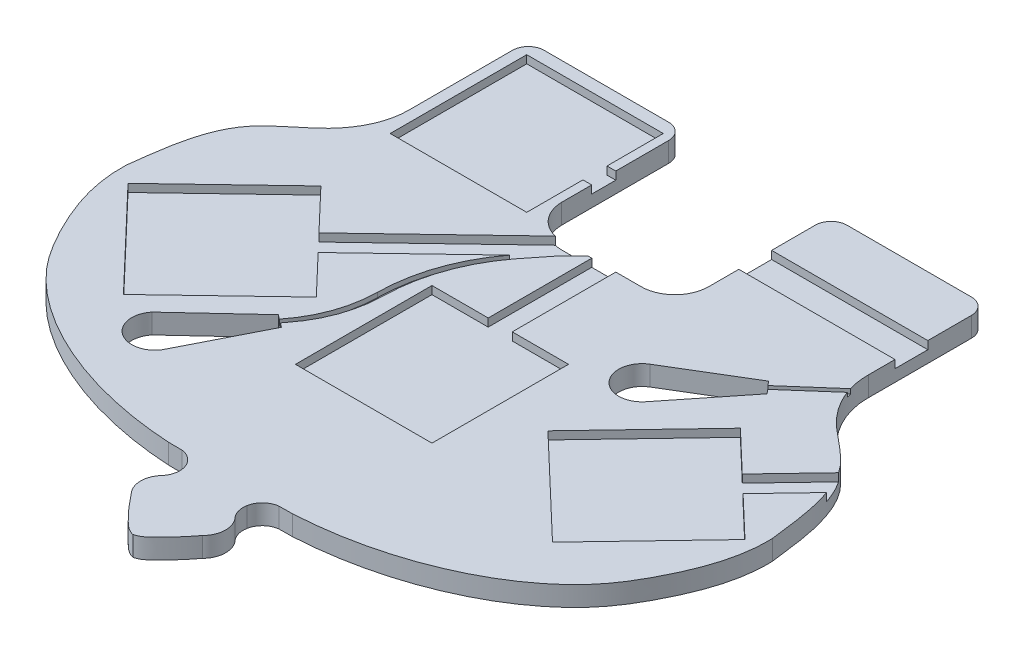
from build123d import *

# Parameters (mm, degrees)
BOSS_EXTRUDE1_DEPTH = 6.35
SKETCH2_W           = 43.7
SKETCH2_H           = 43.7
CUT_EXTRUDE1_DEPTH  = 2.54
CUT_EXTRUDE3_DEPTH  = 2.54
SKETCH4_W           = 2.8
SKETCH4_H           = 7.7
SKETCH4_W_2         = 7.7
SKETCH4_H_2         = 33.528
CUT_EXTRUDE4_DEPTH  = 2.54
CUT_EXTRUDE6_DEPTH  = 165.648464375
CUT_EXTRUDE7_DEPTH  = 1.5
SKETCH9_W           = 50
SKETCH9_H           = 10.5
CUT_EXTRUDE8_DEPTH  = 2.54


with BuildPart() as part:
    # Sketch1 → Boss-Extrude1 (new body)
    with BuildSketch(Plane(origin=(0, 0, 0), x_dir=(1, 0, 0), z_dir=(0, 1, 0))):
        with BuildLine():
            Line((52.544610399, 96), (92.384610399, 96))
            ThreePointArc((92.384610399, 96), (95.976712847, 94.512102448), (97.464610399, 90.92))
            Line((97.464610399, 90.92), (97.464610399, 57.942930422))
            add(Edge.make_bspline(
                [(127.445958891, -2.757399797), (126.217398064, 6.772879157), (124.527871566, 26.937506289), (103.198818931, 39.120916323), (97.37297865, 51.416446236), (97.464610399, 57.942930422)],
                knots=[0, 0, 0, 0, 0.4542014, 0.725733713, 1, 1, 1, 1], degree=3))
            add(Edge.make_bspline(
                [(127.445958891, -2.757399797), (127.822967418, -13.097877655), (122.880457127, -26.665652965), (112.775276891, -43.705151038), (101.21628269, -54.346897272), (78.643551493, -67.273421727), (58.317264726, -71.917502632), (43.855300998, -72.741727337)],
                knots=[0, 0, 0, 0, 0.251847695, 0.354064973, 0.49200618, 0.63769577, 1, 1, 1, 1], degree=3))
            Line((43.855300998, -72.741727337), (39.503738361, -72.784901588))
            ThreePointArc((39.503738361, -72.784901588), (36.074693376, -74.391591034), (34.256026209, -77.71307417))
            ThreePointArc((34.256026209, -77.71307417), (34.316151416, -80.336736497), (35.431566201, -82.712250947))
            ThreePointArc((35.431566201, -82.712250947), (37.591781392, -87.927471757), (35.431566201, -93.142692568))
            add(Edge.make_bspline(
                [(35.431566201, -93.142692568), (33.316240589, -95.95188132), (29.837032497, -99.83422186), (25.835087368, -103.598548459), (24, -104.01567246)],
                knots=[0, 0, 0, 0, 0.654699401, 1, 1, 1, 1], degree=3))
            add(Edge.make_bspline(
                [(12.568433799, -93.142692568), (14.683759411, -95.95188132), (18.162967503, -99.83422186), (22.164912632, -103.598548459), (24, -104.01567246)],
                knots=[0, 0, 0, 0, 0.654699401, 1, 1, 1, 1], degree=3))
            ThreePointArc((12.568433799, -93.142692568), (10.408218608, -87.927471757), (12.568433799, -82.712250947))
            ThreePointArc((12.568433799, -82.712250947), (13.683848584, -80.336736497), (13.743973791, -77.71307417))
            ThreePointArc((13.743973791, -77.71307417), (11.925306624, -74.391591034), (8.496261639, -72.784901588))
            Line((8.496261639, -72.784901588), (4.144699002, -72.741727337))
            add(Edge.make_bspline(
                [(-79.445958891, -2.757399797), (-79.822967418, -13.097877655), (-74.880457127, -26.665652965), (-64.775276891, -43.705151038), (-53.21628269, -54.346897272), (-30.643551493, -67.273421727), (-10.317264726, -71.917502632), (4.144699002, -72.741727337)],
                knots=[0, 0, 0, 0, 0.251847695, 0.354064973, 0.49200618, 0.63769577, 1, 1, 1, 1], degree=3))
            add(Edge.make_bspline(
                [(-79.445958891, -2.757399797), (-78.217398064, 6.772879157), (-76.527871566, 26.937506289), (-55.198818931, 39.120916323), (-49.37297865, 51.416446236), (-49.464610399, 57.942930422)],
                knots=[0, 0, 0, 0, 0.4542014, 0.725733713, 1, 1, 1, 1], degree=3))
            Line((-49.464610399, 57.942930422), (-49.464610399, 90.92))
            ThreePointArc((-49.464610399, 90.92), (-47.976712847, 94.512102448), (-44.384610399, 96))
            Line((-44.384610399, 96), (-4.544610399, 96))
            ThreePointArc((-4.544610399, 96), (-0.95250795, 94.512102448), (0.535389601, 90.92))
            Line((0.535389601, 90.92), (0.535389601, 56.693089242))
            ThreePointArc((0.535389601, 56.693089242), (3.823086605, 49.0674139), (11.540006197, 46))
            Line((11.540006197, 46), (36.459993803, 46))
            ThreePointArc((36.459993803, 46), (44.176913395, 49.0674139), (47.464610399, 56.693089242))
            Line((47.464610399, 56.693089242), (47.464610399, 90.92))
            ThreePointArc((47.464610399, 90.92), (48.95250795, 94.512102448), (52.544610399, 96))
        make_face()
    extrude(amount=BOSS_EXTRUDE1_DEPTH)

    # Sketch2 → Cut-Extrude1 (cut)
    with BuildSketch(Plane(origin=(0, 6.35, 0), x_dir=(1, 0, 0), z_dir=(0, 1, 0))):
        with Locations((-24.114610399, 70.15)):
            Rectangle(SKETCH2_W, SKETCH2_H)
        with Locations((24.69959658, -8.994026969)):
            Rectangle(SKETCH2_W, SKETCH2_H)
        Polygon((91.756041109, 22.663971871), (61.687394919, -8.87), (93.287751095, -39.001945738), (123.356397284, -7.467973867), align=None)
        Polygon((-44.043312702, -39.001945738), (-74.111958891, -7.467973867), (-42.511602716, 22.663971871), (-12.442956526, -8.87), align=None)
    extrude(amount=-CUT_EXTRUDE1_DEPTH, mode=Mode.SUBTRACT)

    # Sketch5 → Cut-Extrude3 (cut)
    with BuildSketch(Plane(origin=(0, 6.35, 0), x_dir=(1, 0, 0), z_dir=(0, 1, 0))):
        Polygon((104.769890137, 10.254852474), (122.226588264, 28.562262267), (128.147086585, 23.613346709), (110.342548256, 4.94114553), align=None)
        Polygon((11.522520215, 48.786329059), (-29.825516941, 9.359659151), (-24.511809997, 3.787001032), (16.836227159, 43.213670941), (19.758341498, 46), align=None)
    extrude(amount=-CUT_EXTRUDE3_DEPTH, mode=Mode.SUBTRACT)

    # Sketch4 → Cut-Extrude4 (cut)
    with BuildSketch(Plane(origin=(0, 6.35, 0), x_dir=(1, 0, 0), z_dir=(0, 1, 0))):
        with Locations((-0.864610399, 70.15)):
            Rectangle(SKETCH4_W, SKETCH4_H)
        with Locations((24.700041109, 29.236)):
            Rectangle(SKETCH4_W_2, SKETCH4_H_2)
    extrude(amount=-CUT_EXTRUDE4_DEPTH, mode=Mode.SUBTRACT)

    # Sketch6 → Cut-Extrude6 (cut, through all)
    with BuildSketch(Plane(origin=(0, 6.35, 0), x_dir=(1, 0, 0), z_dir=(0, 1, 0))):
        with BuildLine():
            Line((86.506282583, 36.458848797), (69.305686566, 14.862795995))
            ThreePointArc((69.305686566, 14.862795995), (57.802795593, 14.587410011), (59.565699046, 25.95774464))
            Line((59.565699046, 25.95774464), (83.207643636, 40.216372063))
            Line((83.207643636, 40.216372063), (86.506282583, 36.458848797))
        make_face()
        with BuildLine():
            Line((-10.890245417, -21.894543883), (-9.654995767, -22.825371259))
            Line((-9.654995767, -22.825371259), (-22.640520119, -48.35628634))
            ThreePointArc((-22.640520119, -48.35628634), (-33.316925376, -50.071712063), (-34.61076845, -39.336057229))
            Line((-34.61076845, -39.336057229), (-13.648173317, -19.816296144))
            Line((-13.648173317, -19.816296144), (-12.475776388, -20.699760598))
            Line((-12.475776388, -20.699760598), (-10.890245417, -21.894543883))
        make_face()
    extrude(amount=-CUT_EXTRUDE6_DEPTH, mode=Mode.SUBTRACT)

    # Sketch8 → Cut-Extrude7 (cut)
    with BuildSketch(Plane(origin=(0, 6.35, 0), x_dir=(1, 0, 0), z_dir=(0, 1, 0))):
        with BuildLine():
            ThreePointArc((-10.298257622, -20.773023834), (-4.271120984, -10.022070609), (-2.051088275, 2.101494298))
            ThreePointArc((-2.051088275, 2.101494298), (0.822630209, 18.715850278), (8.785888639, 33.577936193))
            Line((8.785888639, 33.577936193), (15.212793605, 41.665675358))
            Line((15.212793605, 41.665675358), (6.835409986, 33.67757335))
            ThreePointArc((6.835409986, 33.67757335), (-1.127848444, 18.815487435), (-4.001566928, 2.201131456))
            ThreePointArc((-4.001566928, 2.201131456), (-6.191058386, -10.025989743), (-12.251111868, -20.869057457))
            Line((-12.251111868, -20.869057457), (-11.052607664, -21.772195154))
            Line((-11.052607664, -21.772195154), (-10.298257622, -20.773023834))
        make_face()
        Polygon((85.351758952, 37.77398194), (102.619850578, 52.933222628), (101.470052745, 53.919838498), (84.362167268, 38.90123892), align=None)
    extrude(amount=-CUT_EXTRUDE7_DEPTH, mode=Mode.SUBTRACT)

    # Sketch9 → Cut-Extrude8 (cut)
    with BuildSketch(Plane(origin=(0, 6.35, 0), x_dir=(1, 0, 0), z_dir=(0, 1, 0))):
        with Locations((72.464610399, 71.7)):
            Rectangle(SKETCH9_W, SKETCH9_H)
    extrude(amount=-CUT_EXTRUDE8_DEPTH, mode=Mode.SUBTRACT)


solid = part.part
